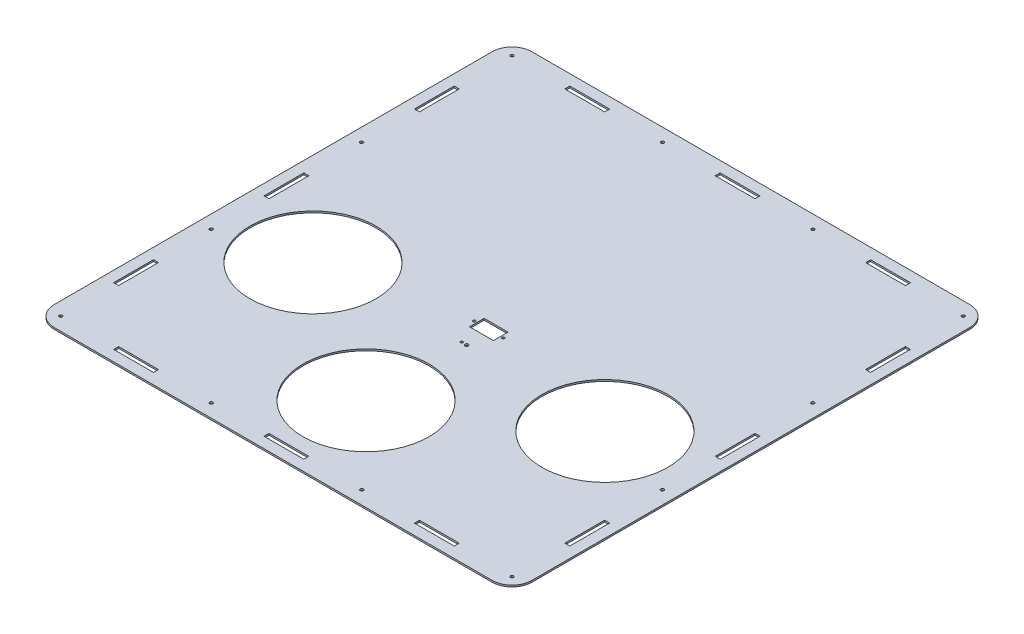
from build123d import *

# Parameters (mm, degrees)
SKETCH1_W             = 457.2
SKETCH1_H             = 457.2
MAIN_PLATE_DEPTH      = 1.5875
SKETCH2_R             = 60.325
DRUM_HOLES_DEPTH      = 1.5875
SKETCH4_R             = 1.190625
SKETCH4_R_2           = 1.5875
IR_HOLES_DEPTH        = 1.5875
SKETCH5_R             = 1.48828125
BOLT_HOLES_DEPTH      = 1.5875
SKETCH7_R             = 1.190625
SKETCH7_W             = 22.86
SKETCH7_H             = 13.97
SERVO_DEPTH           = 1.5875
SKETCH8_W             = 4.7625
SKETCH8_H             = 38.1
SKETCH8_W_2           = 38.1
SKETCH8_H_2           = 4.7625
ALIGNMENT_HOLES_DEPTH = 1.5875
FILLET1_R             = 19.05


with BuildPart() as part:
    # Sketch1 → Main Plate (new body)
    with BuildSketch(Plane(origin=(0, 0, 0), x_dir=(1, 0, 0), z_dir=(0, 1, 0))):
        Rectangle(SKETCH1_W, SKETCH1_H)
    extrude(amount=MAIN_PLATE_DEPTH)

    # Sketch2 → Drum Holes (cut)
    with BuildSketch(Plane(origin=(0, 1.5875, 0), x_dir=(1, 0, 0), z_dir=(0, 1, 0))):
        with Locations(Location((0, -139.7, 0), (0, 0, 270))):
            Circle(SKETCH2_R)
        with Locations(Location((-139.7, -50.8, 0), (0, 0, 270))):
            Circle(SKETCH2_R)
        with Locations(Location((139.7, -50.8, 0), (0, 0, 90))):
            Circle(SKETCH2_R)
    extrude(amount=-DRUM_HOLES_DEPTH, mode=Mode.SUBTRACT)

    # Sketch4 → IR Holes (cut)
    with BuildSketch(Plane(origin=(0, 1.5875, 0), x_dir=(1, 0, 0), z_dir=(0, 1, 0))):
        with Locations(Location((-2.38125, -45.72, 0), (0, 0, 270))):
            Circle(SKETCH4_R)
        with Locations(Location((2.38125, -45.72, 0), (0, 0, 270))):
            Circle(SKETCH4_R_2)
    extrude(amount=-IR_HOLES_DEPTH, mode=Mode.SUBTRACT)

    # Sketch5 → Bolt Holes (cut)
    with BuildSketch(Plane(origin=(0, 1.5875, 0), x_dir=(1, 0, 0), z_dir=(0, 1, 0))):
        with Locations(Location((-215.9, 215.9, 0), (0, 0, 270))):
            Circle(SKETCH5_R)
        with Locations(Location((-215.9, 71.966666667, 0), (0, 0, 270))):
            Circle(SKETCH5_R)
        with Locations(Location((-215.9, -71.966666667, 0), (0, 0, 270))):
            Circle(SKETCH5_R)
        with Locations(Location((-215.9, -215.9, 0), (0, 0, 270))):
            Circle(SKETCH5_R)
        with Locations(Location((-71.882, 215.9, 0), (0, 0, 270))):
            Circle(SKETCH5_R)
        with Locations(Location((72.136, 215.9, 0), (0, 0, 270))):
            Circle(SKETCH5_R)
        with Locations(Location((215.9, 215.9, 0), (0, 0, 90))):
            Circle(SKETCH5_R)
        with Locations(Location((215.9, 71.966666667, 0), (0, 0, 90))):
            Circle(SKETCH5_R)
        with Locations(Location((215.9, -71.966666667, 0), (0, 0, 90))):
            Circle(SKETCH5_R)
        with Locations(Location((215.9, -215.9, 0), (0, 0, 90))):
            Circle(SKETCH5_R)
        with Locations(Location((72.136, -215.9, 0), (0, 0, 90))):
            Circle(SKETCH5_R)
        with Locations(Location((-71.882, -215.9, 0), (0, 0, 90))):
            Circle(SKETCH5_R)
    extrude(amount=-BOLT_HOLES_DEPTH, mode=Mode.SUBTRACT)

    # Sketch7 → Servo (cut)
    with BuildSketch(Plane(origin=(0, 1.5875, 0), x_dir=(1, 0, 0), z_dir=(0, 1, 0))):
        with Locations(Location((-13.890625, -22.225, 0), (0, 0, 270))):
            Circle(SKETCH7_R)
        with Locations(Location((13.890625, -22.225, 0), (0, 0, 270))):
            Circle(SKETCH7_R)
        with Locations((0, -22.225)):
            Rectangle(SKETCH7_W, SKETCH7_H)
    extrude(amount=-SERVO_DEPTH, mode=Mode.SUBTRACT)

    # Sketch8 → Alignment Holes (cut)
    with BuildSketch(Plane(origin=(0, 1.5875, 0), x_dir=(1, 0, 0), z_dir=(0, 1, 0))):
        with Locations((-215.9, -143.933333333)):
            Rectangle(SKETCH8_W, SKETCH8_H)
        with Locations((-215.9, 0)):
            Rectangle(SKETCH8_W, SKETCH8_H)
        with Locations((215.9, -143.933333333)):
            Rectangle(SKETCH8_W, SKETCH8_H)
        with Locations((-215.9, 143.933333333)):
            Rectangle(SKETCH8_W, SKETCH8_H)
        with Locations((215.9, 0)):
            Rectangle(SKETCH8_W, SKETCH8_H)
        with Locations((215.9, 143.933333333)):
            Rectangle(SKETCH8_W, SKETCH8_H)
        with Locations((-143.891, 215.9)):
            Rectangle(SKETCH8_W_2, SKETCH8_H_2)
        with Locations((144.018, 215.9)):
            Rectangle(SKETCH8_W_2, SKETCH8_H_2)
        with Locations((0, 215.9)):
            Rectangle(SKETCH8_W_2, SKETCH8_H_2)
        with Locations((144.018, -215.9)):
            Rectangle(SKETCH8_W_2, SKETCH8_H_2)
        with Locations((0, -215.9)):
            Rectangle(SKETCH8_W_2, SKETCH8_H_2)
        with Locations((-143.891, -215.9)):
            Rectangle(SKETCH8_W_2, SKETCH8_H_2)
    extrude(amount=-ALIGNMENT_HOLES_DEPTH, mode=Mode.SUBTRACT)

    # Fillet1
    fillet1_edges = [part.edges().sort_by_distance(p)[0] for p in [
        (228.6, 0.79375, 228.6),
        (-228.6, 0.79375, 228.6),
        (-228.6, 0.79375, -228.6),
        (228.6, 0.79375, -228.6),
    ]]
    fillet(fillet1_edges, radius=FILLET1_R)


solid = part.part
